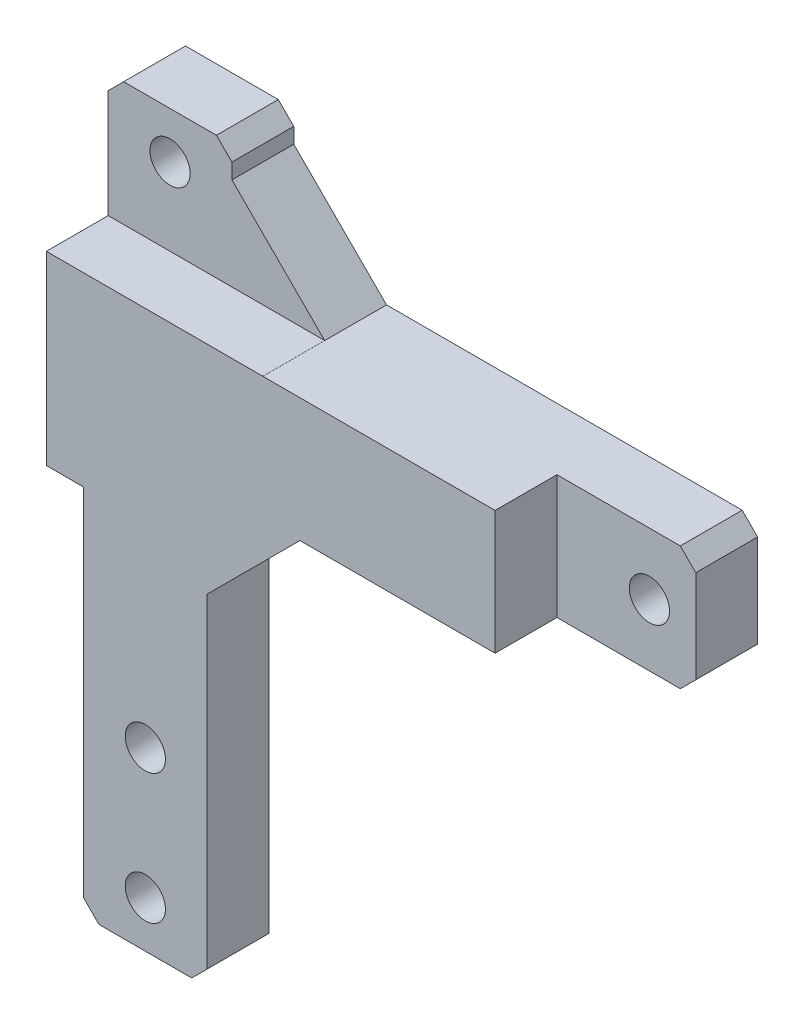
from build123d import *

# Parameters (mm, degrees)
SKETCH_1_R          = 0.65
EXTRUDE_1_DEPTH     = 4
SKETCH_2_W          = 4
SKETCH_2_H          = 11.631287185
SKETCH_2_R          = 0.65
CUT_EXTRUDE_1_DEPTH = 2
CUT_EXTRUDE_START   = 2
SKETCH_3_W          = 4.48994314
SKETCH_3_H          = 4
SKETCH_3_R          = 0.65
SKETCH_3_W_2        = 4
SKETCH_3_H_2        = 3.998874997
CUT_EXTRUDE_2_DEPTH = 2
CHAMFER_1_SIZE      = 3
CHAMFER_2_SIZE      = 0.5


with BuildPart() as part:
    # 草图1 → 凸台-拉伸1 (new body)
    with BuildSketch(Plane.XY):
        Polygon((-4.3, -2.5), (9.5, -2.5), (9.5, 1.5), (-5.5, 1.5), (-5.5, 5.5), (-9.5, 5.5), (-9.5, 1.5), (-9.5, -4.5), (-8.3, -4.5), (-8.3, -16.5), (-4.3, -16.5), align=None)
        with Locations((8, -0.5)):
            Circle(SKETCH_1_R, mode=Mode.SUBTRACT)
        with Locations((-7.5, 4)):
            Circle(SKETCH_1_R, mode=Mode.SUBTRACT)
        with Locations((-6.3, -15)):
            Circle(SKETCH_1_R, mode=Mode.SUBTRACT)
        with Locations((-6.3, -10.8)):
            Circle(SKETCH_1_R, mode=Mode.SUBTRACT)
    extrude(amount=EXTRUDE_1_DEPTH)

    # 草图2 → 切除-拉伸1 (cut)
    with BuildSketch(Plane.XY):
        with Locations((-6.3, -10.684356408)):
            Rectangle(SKETCH_2_W, SKETCH_2_H)
        with Locations((-6.3, -15)):
            Circle(SKETCH_2_R, mode=Mode.SUBTRACT)
        with Locations((-6.3, -10.8)):
            Circle(SKETCH_2_R, mode=Mode.SUBTRACT)
    extrude(amount=CUT_EXTRUDE_1_DEPTH, mode=Mode.SUBTRACT)

    # 草图3 → 切除-拉伸2 (cut)
    # profile 1 of 2: a face of its own
    with BuildSketch(Plane(origin=(0, 0, 4), x_dir=(-1, 0, 0), z_dir=(0, 0, -1)).offset(CUT_EXTRUDE_START)):
        with Locations((-7.25502843, -0.5)):
            Rectangle(SKETCH_3_W, SKETCH_3_H)
        with Locations((-8, -0.5)):
            Circle(SKETCH_3_R, mode=Mode.SUBTRACT)
    # profile 2 of 2: a face of its own
    with BuildSketch(Plane(origin=(0, 0, 4), x_dir=(-1, 0, 0), z_dir=(0, 0, -1)).offset(CUT_EXTRUDE_START)):
        with Locations((7.5, 3.500562502)):
            Rectangle(SKETCH_3_W_2, SKETCH_3_H_2)
        with Locations((7.5, 4)):
            Circle(SKETCH_3_R, mode=Mode.SUBTRACT)
    extrude(amount=-CUT_EXTRUDE_2_DEPTH, mode=Mode.SUBTRACT)

    # 倒角1
    chamfer_1_edges = [part.edges().sort_by_distance(p)[0] for p in [
        (-4.3, -2.5, 2),
        (-5.5, 1.5, 2),
    ]]
    chamfer(chamfer_1_edges, length=CHAMFER_1_SIZE)

    # 倒角2
    chamfer_2_edges = [part.edges().sort_by_distance(p)[0] for p in [
        (-4.3, -16.5, 3),
        (-8.3, -16.5, 3),
        (9.5, -2.5, 1),
        (-9.5, 5.5, 1),
        (-5.5, 5.5, 1),
        (9.5, 1.5, 1),
    ]]
    chamfer(chamfer_2_edges, length=CHAMFER_2_SIZE)


solid = part.part
